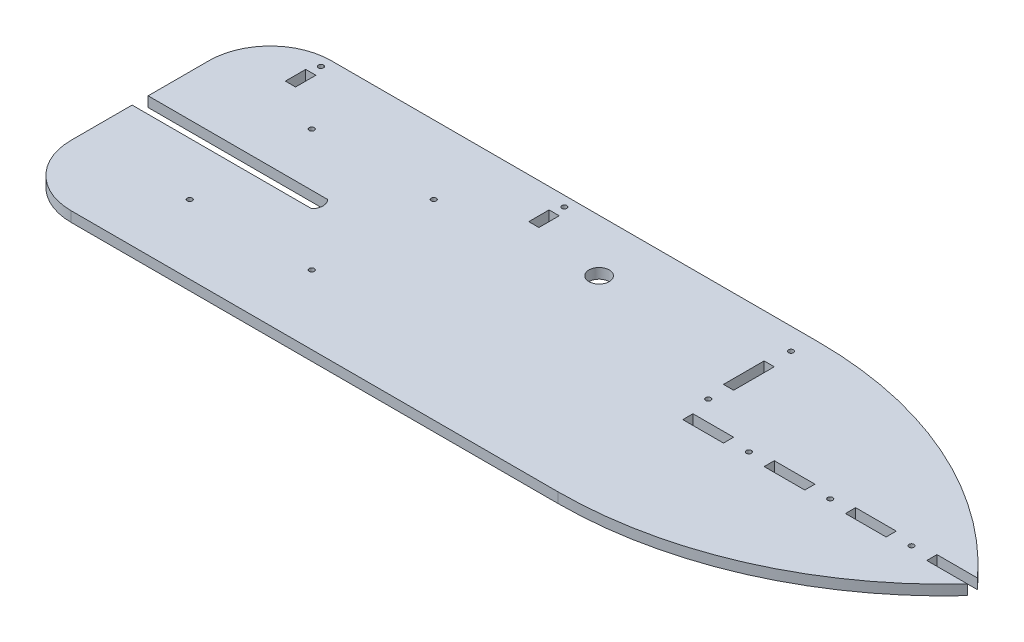
from build123d import *

# Parameters (mm, degrees)
SKETCH1_R           = 1.5875
SKETCH1_R_2         = 6.35
SKETCH1_W           = 25.4
SKETCH1_H           = 6.35
SKETCH1_W_2         = 6.35
SKETCH1_H_2         = 25.4
BOSS_EXTRUDE1_DEPTH = 6.35


with BuildPart() as part:
    # Sketch1 → Boss-Extrude1 (new body)
    with BuildSketch(Plane(origin=(0, 0, 0), x_dir=(1, 0, 0), z_dir=(0, 1, 0))):
        with BuildLine():
            Line((-158.372209236, 3.874169231), (-259.972209236, 3.874169231))
            Line((-259.972209236, 3.874169231), (-259.972209236, 41.974169231))
            ThreePointArc((-259.972209236, 41.974169231), (-248.8129776, 68.914937594), (-221.872209236, 80.074169231))
            Line((-221.872209236, 80.074169231), (82.172209236, 80.074169231))
            ThreePointArc((82.172209236, 80.074169231), (179.256365551, 59.708562917), (259.972209236, 2.045369231))
            Line((259.972209236, 2.045369231), (234.572209236, 2.045369231))
            Line((234.572209236, 2.045369231), (234.572209236, -4.304630769))
            Line((234.572209236, -4.304630769), (259.972209236, -4.304630769))
            ThreePointArc((259.972209236, -4.304630769), (179.256365551, -61.967824455), (82.172209236, -82.333430769))
            Line((82.172209236, -82.333430769), (-221.872209236, -82.333430769))
            ThreePointArc((-221.872209236, -82.333430769), (-248.8129776, -71.174199132), (-259.972209236, -44.233430769))
            Line((-259.972209236, -44.233430769), (-259.972209236, -6.133430769))
            Line((-259.972209236, -6.133430769), (-158.372209236, -6.133430769))
            Line((-158.372209236, -6.133430769), (-147.882694507, -6.133430769))
            ThreePointArc((-147.882694507, -6.133430769), (-145.777792064, -1.129630769), (-147.882694507, 3.874169231))
            Line((-147.882694507, 3.874169231), (-158.372209236, 3.874169231))
        make_face()
        with Locations(Location((-190.877790764, -39.229630769, 0), (0, 0, 270))):
            Circle(SKETCH1_R, mode=Mode.SUBTRACT)
        with Locations(Location((-114.677790764, -39.229630769, 0), (0, 0, 270))):
            Circle(SKETCH1_R, mode=Mode.SUBTRACT)
        with Locations(Location((-114.677790764, 36.970369231, 0), (0, 0, 270))):
            Circle(SKETCH1_R, mode=Mode.SUBTRACT)
        with Locations(Location((-190.877790764, 36.970369231, 0), (0, 0, 270))):
            Circle(SKETCH1_R, mode=Mode.SUBTRACT)
        with Locations(Location((120.272209236, -1.129630769, 0), (0, 0, 270))):
            Circle(SKETCH1_R, mode=Mode.SUBTRACT)
        with Locations(Location((171.072209236, -1.129630769, 0), (0, 0, 270))):
            Circle(SKETCH1_R, mode=Mode.SUBTRACT)
        with Locations(Location((221.872209236, -1.129630769, 0), (0, 0, 270))):
            Circle(SKETCH1_R, mode=Mode.SUBTRACT)
        with Locations(Location((78.997209236, 14.745369231, 0), (0, 0, 270))):
            Circle(SKETCH1_R, mode=Mode.SUBTRACT)
        with Locations(Location((78.997209236, 66.459769231, 0), (0, 0, 270))):
            Circle(SKETCH1_R, mode=Mode.SUBTRACT)
        with Locations(Location((-21.766377903, 47.368819725, 0), (0, 0, 270))):
            Circle(SKETCH1_R_2, mode=Mode.SUBTRACT)
        with Locations(Location((-221.872209236, 73.724169231, 0), (0, 0, 270))):
            Circle(SKETCH1_R, mode=Mode.SUBTRACT)
        with Locations(Location((-69.85, 73.724169231, 0), (0, 0, 270))):
            Circle(SKETCH1_R, mode=Mode.SUBTRACT)
        with Locations((94.872209236, -1.129630769)):
            Rectangle(SKETCH1_W, SKETCH1_H, mode=Mode.SUBTRACT)
        with Locations((145.672209236, -1.129630769)):
            Rectangle(SKETCH1_W, SKETCH1_H, mode=Mode.SUBTRACT)
        with Locations((196.472209236, -1.129630769)):
            Rectangle(SKETCH1_W, SKETCH1_H, mode=Mode.SUBTRACT)
        with Locations((78.997209236, 40.145369231)):
            Rectangle(SKETCH1_W_2, SKETCH1_H_2, mode=Mode.SUBTRACT)
        Polygon((-221.872209236, 67.374169231), (-218.697209236, 67.374169231), (-218.697209236, 54.674169231), (-225.047209236, 54.674169231), (-225.047209236, 67.374169231), align=None, mode=Mode.SUBTRACT)
        Polygon((-69.85, 67.374169231), (-66.675, 67.374169231), (-66.675, 54.674169231), (-73.025, 54.674169231), (-73.025, 67.374169231), align=None, mode=Mode.SUBTRACT)
    extrude(amount=BOSS_EXTRUDE1_DEPTH)


solid = part.part
